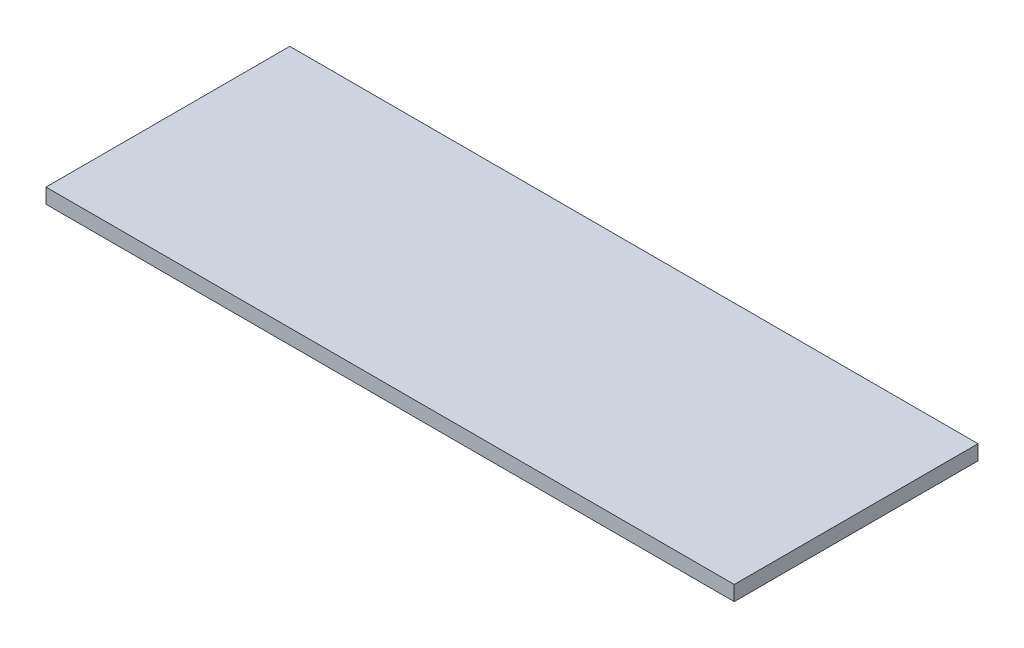
from build123d import *

# Parameters (mm, degrees)
SKETCH1_W           = 152.4
SKETCH1_H           = 53.975
BOSS_EXTRUDE1_DEPTH = 3.302


with BuildPart() as part:
    # Sketch1 → Boss-Extrude1 (new body)
    with BuildSketch(Plane(origin=(0, 0, 0), x_dir=(1, 0, 0), z_dir=(0, 1, 0))):
        Rectangle(SKETCH1_W, SKETCH1_H)
    extrude(amount=BOSS_EXTRUDE1_DEPTH)


solid = part.part
